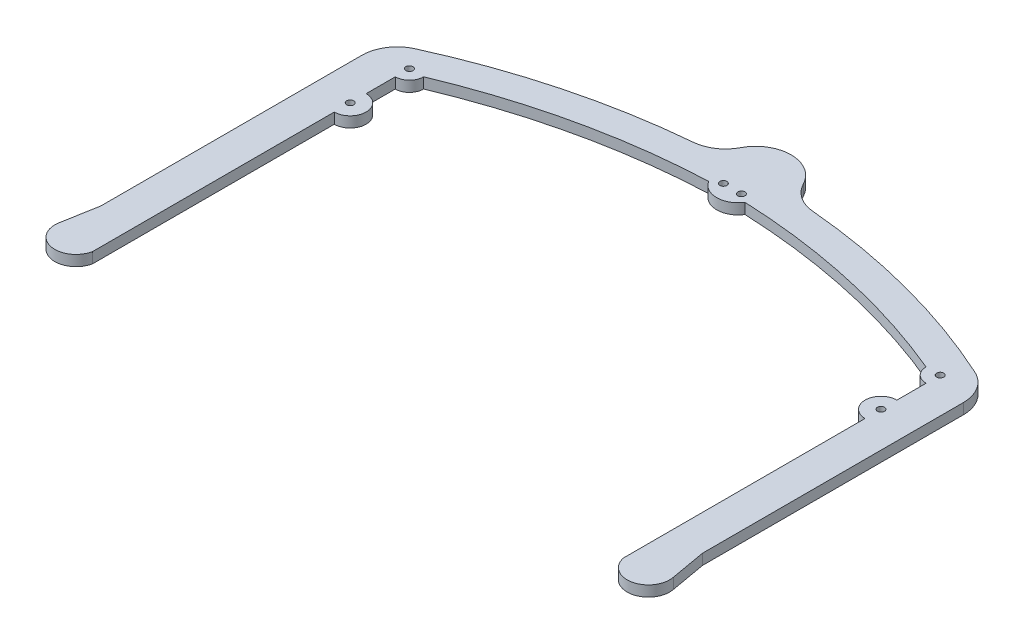
from build123d import *

# Parameters (mm, degrees)
BOSS_EXTRUDE2_DEPTH      = 3
FILLET3_R                = 10
FILLET3_OF_MIRROR3_R     = 10
BOSS_EXTRUDE3_START      = -3
BOSS_EXTRUDE3_DEPTH      = 3
F_2_0_2_DIAMETER_HOLE1_D = 2


with BuildPart() as part:
    # Sketch2 → Boss-Extrude2 (new body)
    with BuildSketch(Plane(origin=(0, 0, 0), x_dir=(1, 0, 0), z_dir=(0, 1, 0))):
        with BuildLine():
            ThreePointArc((0, 117.185905081), (5, 117.120320028), (9.996559473, 116.923609999))
            ThreePointArc((9.996559473, 116.923609999), (7.163202874, 124.163621369), (0, 127.185905081))
            Line((0, 127.185905081), (0, 117.185905081))
        make_face()
        with BuildLine():
            Line((75, 92.603329386), (75, 4.814094919))
            ThreePointArc((75, 4.814094919), (82.067539985, 0.118365096), (86.763269807, 7.185905081))
            Line((86.763269807, 7.185905081), (85, 17.185905081))
            Line((85, 17.185905081), (85, 97.185905081))
            ThreePointArc((85, 97.185905081), (43.660622991, 112.118552795), (0, 117.185905081))
            Line((0, 117.185905081), (0, 109.185905081))
            ThreePointArc((0, 109.185905081), (38.343884954, 104.711356725), (75, 92.603329386))
        make_face()
    boss_extrude2 = extrude(amount=BOSS_EXTRUDE2_DEPTH)

    # Fillet3
    fillet3_edges = [part.edges().sort_by_distance(p)[0] for p in [
        (9.996559473, 1.5, -116.923609999),
        (85, 1.5, -97.185905081),
    ]]
    fillet(fillet3_edges, radius=FILLET3_R)

    # Mirror3: Boss-Extrude2 across plane
    add(boss_extrude2.mirror(Plane(origin=(0, 3, 0), x_dir=(0, 0, 1), z_dir=(1, 0, 0))))

    # Fillet3 of Mirror3
    fillet3_of_mirror3_edges = [part.edges().sort_by_distance(p)[0] for p in [
        (-9.996559473, 1.5, -116.923609999),
        (-85, 1.5, -97.185905081),
    ]]
    fillet(fillet3_of_mirror3_edges, radius=FILLET3_OF_MIRROR3_R)

    # Sketch4 → Boss-Extrude3 (add)
    with BuildSketch(Plane(origin=(0, 3, 0), x_dir=(1, 0, 0), z_dir=(0, 1, 0)).offset(BOSS_EXTRUDE3_START)):
        with BuildLine():
            Line((0, 109.185905081), (0, 106.185905081))
            ThreePointArc((0, 106.185905081), (2.927170094, 106.948379402), (5.110376179, 109.042013335))
            ThreePointArc((5.110376179, 109.042013335), (2.555670493, 109.131091975), (0, 109.185905081))
        make_face()
        with BuildLine():
            ThreePointArc((75, 92.603329386), (73.004956974, 93.481711721), (71, 94.337223109))
            ThreePointArc((71, 94.337223109), (72.171572875, 91.508795985), (75, 90.337223109))
            Line((75, 90.337223109), (75, 92.603329386))
        make_face()
        with BuildLine():
            Line((75, 73.103329386), (75, 82.103329386))
            ThreePointArc((75, 82.103329386), (70.5, 77.603329386), (75, 73.103329386))
        make_face()
    boss_extrude3 = extrude(amount=BOSS_EXTRUDE3_DEPTH)

    # Mirror4: Boss-Extrude3 across plane
    add(boss_extrude3.mirror(Plane(origin=(0, 0, 0), x_dir=(0, 0, 1), z_dir=(1, 0, 0))))

    # Ø2.0 (2) Diameter Hole1 (through all)
    with Locations(Plane(origin=(2.555188089, 3, -110.613959208), x_dir=(0, 0, 1), z_dir=(0, 1, 0))):
        with Locations((0, 0), (16.276736099, 72.444811911), (33.010629822, 72.444811911)):
            f_2_0_2_diameter_hole1 = Hole(F_2_0_2_DIAMETER_HOLE1_D / 2)

    # Mirror5: Ø2.0 (2) Diameter Hole1 across plane
    add(f_2_0_2_diameter_hole1.mirror(Plane(origin=(0, 0, 0), x_dir=(0, 0, 1), z_dir=(1, 0, 0))), mode=Mode.SUBTRACT)


solid = part.part
